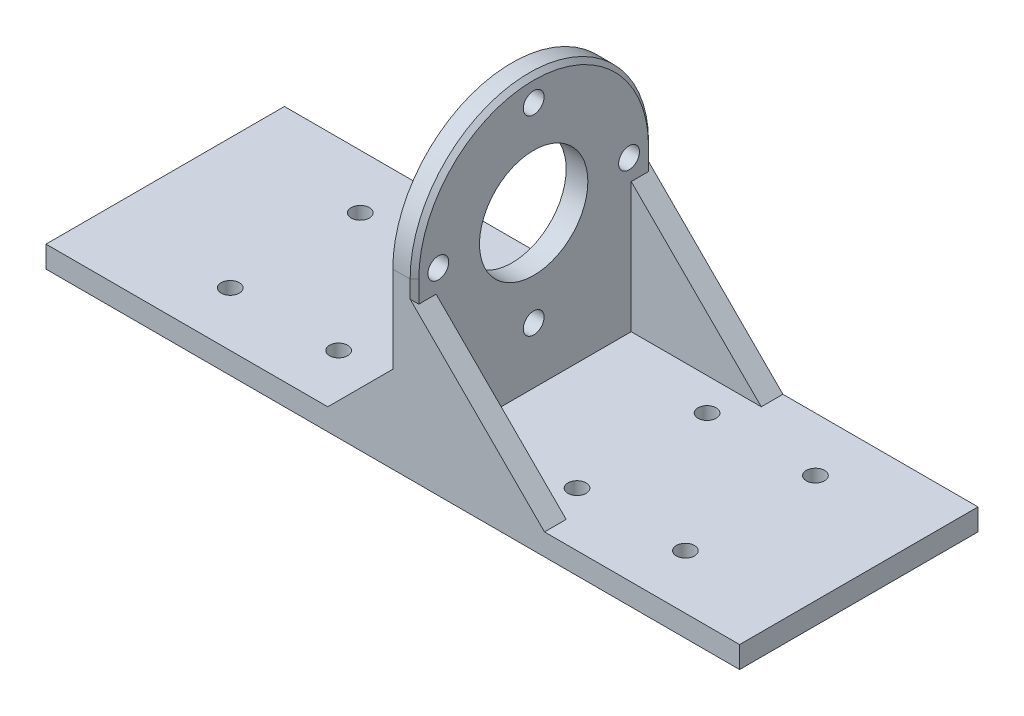
from build123d import *

# Parameters (mm, degrees)
SKETCH_1_R          = 12.5
SKETCH_1_R_2        = 2.4
EXTRUDE_1_DEPTH     = 5
SKETCH_2_W          = 55
SKETCH_2_H          = 5
EXTRUDE_2_DEPTH     = 80
RIB_1_REACH         = 105.712
SKETCH_3_WALL_W     = 230.637888562
SKETCH_3_WALL_H     = 5
CHAMFER_2_SIZE      = 5
SKETCH_4_W          = 55
SKETCH_4_H          = 5
EXTRUDE_3_DEPTH     = 75
RIB_6_REACH         = 105.712
SKETCH_5_WALL_W     = 251.851091998
SKETCH_5_WALL_H     = 5
CUT_EXTRUDE_1_REACH = 107.178
SKETCH_6_R          = 2.1
CHAMFER_3_SIZE      = 1


with BuildPart() as part:
    # 草图1 → 凸台-拉伸1 (new body)
    with BuildSketch(Plane(origin=(0, 0, 0), x_dir=(0, 0, -1), z_dir=(1, 0, 0))):
        with BuildLine():
            Line((-27.5, 0), (-27.5, -40))
            Line((-27.5, -40), (27.5, -40))
            Line((27.5, -40), (27.5, 0))
            ThreePointArc((27.5, 0), (0, 27.5), (-27.5, 0))
        make_face()
        Circle(SKETCH_1_R, mode=Mode.SUBTRACT)
        with Locations((0, 22)):
            Circle(SKETCH_1_R_2, mode=Mode.SUBTRACT)
        with Locations((22, 0)):
            Circle(SKETCH_1_R_2, mode=Mode.SUBTRACT)
        with Locations((0, -22)):
            Circle(SKETCH_1_R_2, mode=Mode.SUBTRACT)
        with Locations((-22, 0)):
            Circle(SKETCH_1_R_2, mode=Mode.SUBTRACT)
    extrude(amount=EXTRUDE_1_DEPTH)

    # 草图2 → 凸台-拉伸2 (add)
    with BuildSketch(Plane.ZY):
        with Locations((0, -37.5)):
            Rectangle(SKETCH_2_W, SKETCH_2_H)
    extrude(amount=EXTRUDE_2_DEPTH)

    # 草图3 wall → 筋1 (add, up to next)
    with BuildSketch(Plane(origin=(-7.5, -27.5, 25), x_dir=(0.707106781187, 0.707106781187, 0), z_dir=(-0.707106781187, 0.707106781187, 0)), mode=Mode.PRIVATE) as rib_1_sk1:
        Rectangle(SKETCH_3_WALL_W, SKETCH_3_WALL_H)
    rib_1_tool1 = extrude(rib_1_sk1.sketch, amount=-RIB_1_REACH, mode=Mode.PRIVATE) - part.part
    rib_1 = rib_1_tool1.solids().sort_by_distance((-7.5, -27.5, 25))[0]
    add(rib_1)

    # 镜向1: 筋1 across plane
    add(rib_1.mirror(Plane.XY))

    # 倒角2
    chamfer_2_edges = [part.edges().sort_by_distance(p)[0] for p in [
        (0, -35, 0),
    ]]
    chamfer(chamfer_2_edges, length=CHAMFER_2_SIZE)

    # 草图4 → 凸台-拉伸3 (add)
    with BuildSketch(Plane(origin=(5, 0, 0), x_dir=(0, 0, -1), z_dir=(1, 0, 0))):
        with Locations((0, -37.5)):
            Rectangle(SKETCH_4_W, SKETCH_4_H)
    extrude(amount=EXTRUDE_3_DEPTH)

    # 草图5 wall → 筋6 (add, up to next)
    with BuildSketch(Plane(origin=(20, -20, 25), x_dir=(-0.707106781187, 0.707106781187, 0), z_dir=(-0.707106781187, -0.707106781187, 0)), mode=Mode.PRIVATE) as rib_6_sk1:
        Rectangle(SKETCH_5_WALL_W, SKETCH_5_WALL_H)
    rib_6_tool1 = extrude(rib_6_sk1.sketch, amount=RIB_6_REACH, mode=Mode.PRIVATE) - part.part
    rib_6 = rib_6_tool1.solids().sort_by_distance((20, -20, 25))[0]
    add(rib_6)

    # 镜向2: 筋6 across plane
    add(rib_6.mirror(Plane.XY))

    # 草图6 → 切除-拉伸1 (cut, up to next)
    with BuildSketch(Plane(origin=(0, -35, 0), x_dir=(1, 0, 0), z_dir=(0, 1, 0)), mode=Mode.PRIVATE) as cut_extrude_1_sk1:
        with Locations(Location((30, 15, 0), (0, 0, 270))):
            Circle(SKETCH_6_R)
    cut_extrude_1_tool1 = extrude(cut_extrude_1_sk1.sketch, amount=-CUT_EXTRUDE_1_REACH, mode=Mode.PRIVATE) & part.part
    # 草图6 → 切除-拉伸1 (cut, up to next)
    with BuildSketch(Plane(origin=(0, -35, 0), x_dir=(1, 0, 0), z_dir=(0, 1, 0)), mode=Mode.PRIVATE) as cut_extrude_1_sk2:
        with Locations(Location((55, 15, 0), (0, 0, 270))):
            Circle(SKETCH_6_R)
    cut_extrude_1_tool2 = extrude(cut_extrude_1_sk2.sketch, amount=-CUT_EXTRUDE_1_REACH, mode=Mode.PRIVATE) & part.part
    # 草图6 → 切除-拉伸1 (cut, up to next)
    with BuildSketch(Plane(origin=(0, -35, 0), x_dir=(1, 0, 0), z_dir=(0, 1, 0)), mode=Mode.PRIVATE) as cut_extrude_1_sk3:
        with Locations(Location((-50, 15, 0), (0, 0, 270))):
            Circle(SKETCH_6_R)
    cut_extrude_1_tool3 = extrude(cut_extrude_1_sk3.sketch, amount=-CUT_EXTRUDE_1_REACH, mode=Mode.PRIVATE) & part.part
    # 草图6 → 切除-拉伸1 (cut, up to next)
    with BuildSketch(Plane(origin=(0, -35, 0), x_dir=(1, 0, 0), z_dir=(0, 1, 0)), mode=Mode.PRIVATE) as cut_extrude_1_sk4:
        with Locations(Location((-25, 15, 0), (0, 0, 270))):
            Circle(SKETCH_6_R)
    cut_extrude_1_tool4 = extrude(cut_extrude_1_sk4.sketch, amount=-CUT_EXTRUDE_1_REACH, mode=Mode.PRIVATE) & part.part
    # 草图6 → 切除-拉伸1 (cut, up to next)
    with BuildSketch(Plane(origin=(0, -35, 0), x_dir=(1, 0, 0), z_dir=(0, 1, 0)), mode=Mode.PRIVATE) as cut_extrude_1_sk5:
        with Locations(Location((55, -15, 0), (0, 0, 270))):
            Circle(SKETCH_6_R)
    cut_extrude_1_tool5 = extrude(cut_extrude_1_sk5.sketch, amount=-CUT_EXTRUDE_1_REACH, mode=Mode.PRIVATE) & part.part
    # 草图6 → 切除-拉伸1 (cut, up to next)
    with BuildSketch(Plane(origin=(0, -35, 0), x_dir=(1, 0, 0), z_dir=(0, 1, 0)), mode=Mode.PRIVATE) as cut_extrude_1_sk6:
        with Locations(Location((30, -15, 0), (0, 0, 270))):
            Circle(SKETCH_6_R)
    cut_extrude_1_tool6 = extrude(cut_extrude_1_sk6.sketch, amount=-CUT_EXTRUDE_1_REACH, mode=Mode.PRIVATE) & part.part
    # 草图6 → 切除-拉伸1 (cut, up to next)
    with BuildSketch(Plane(origin=(0, -35, 0), x_dir=(1, 0, 0), z_dir=(0, 1, 0)), mode=Mode.PRIVATE) as cut_extrude_1_sk7:
        with Locations(Location((-25, -15, 0), (0, 0, 270))):
            Circle(SKETCH_6_R)
    cut_extrude_1_tool7 = extrude(cut_extrude_1_sk7.sketch, amount=-CUT_EXTRUDE_1_REACH, mode=Mode.PRIVATE) & part.part
    # 草图6 → 切除-拉伸1 (cut, up to next)
    with BuildSketch(Plane(origin=(0, -35, 0), x_dir=(1, 0, 0), z_dir=(0, 1, 0)), mode=Mode.PRIVATE) as cut_extrude_1_sk8:
        with Locations(Location((-50, -15, 0), (0, 0, 270))):
            Circle(SKETCH_6_R)
    cut_extrude_1_tool8 = extrude(cut_extrude_1_sk8.sketch, amount=-CUT_EXTRUDE_1_REACH, mode=Mode.PRIVATE) & part.part
    add(cut_extrude_1_tool1.solids().sort_by_distance((30, -35, -15))[0], mode=Mode.SUBTRACT)
    add(cut_extrude_1_tool2.solids().sort_by_distance((55, -35, -15))[0], mode=Mode.SUBTRACT)
    add(cut_extrude_1_tool3.solids().sort_by_distance((-50, -35, -15))[0], mode=Mode.SUBTRACT)
    add(cut_extrude_1_tool4.solids().sort_by_distance((-25, -35, -15))[0], mode=Mode.SUBTRACT)
    add(cut_extrude_1_tool5.solids().sort_by_distance((55, -35, 15))[0], mode=Mode.SUBTRACT)
    add(cut_extrude_1_tool6.solids().sort_by_distance((30, -35, 15))[0], mode=Mode.SUBTRACT)
    add(cut_extrude_1_tool7.solids().sort_by_distance((-25, -35, 15))[0], mode=Mode.SUBTRACT)
    add(cut_extrude_1_tool8.solids().sort_by_distance((-50, -35, 15))[0], mode=Mode.SUBTRACT)

    # 倒角3
    chamfer_3_edges = [part.edges().sort_by_distance(p)[0] for p in [
        (5, -2.5, -27.5),
        (5, 27.5, 0),
        (5, -2.5, 27.5),
    ]]
    chamfer(chamfer_3_edges, length=CHAMFER_3_SIZE)


solid = part.part
